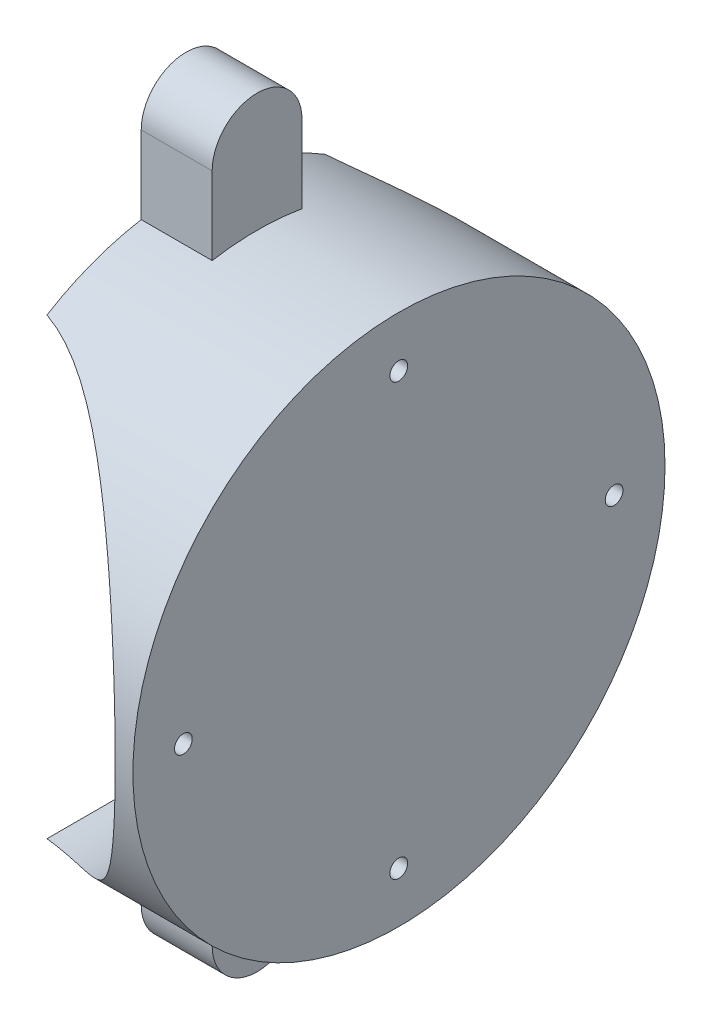
from build123d import *

# Parameters (mm, degrees)
SKETCH1_R               = 75
BOSS_EXTRUDE1_DEPTH     = 60
BOSS_EXTRUDE2_DEPTH     = 20
SKETCH6_R               = 2.5
CUT_EXTRUDE4_DEPTH      = 145.896339998
CIRPATTERN1_COUNT       = 4
CUT_EXTRUDE3_DEPTH      = 145.896339998
CUT_EXTRUDE3_DEPTH_BACK = 145.896339998


with BuildPart() as part:
    # Sketch1 → Boss-Extrude1 (new body)
    with BuildSketch(Plane(origin=(0, 0, 0), x_dir=(0, 0, -1), z_dir=(1, 0, 0))):
        with Locations(Location((0, 0, 0), (0, 0, 180))):
            Circle(SKETCH1_R)
    extrude(amount=BOSS_EXTRUDE1_DEPTH)

    # Sketch5 → Boss-Extrude2 (add)
    with BuildSketch(Plane(origin=(0, 0, 0), x_dir=(0, 0, -1), z_dir=(1, 0, 0))):
        with BuildLine():
            Line((12.661492774, 95.827904611), (12.661492774, -93.388552108))
            ThreePointArc((12.661492774, -93.388552108), (0, -106.050044882), (-12.661492774, -93.388552108))
            Line((-12.661492774, -93.388552108), (-12.661492774, 95.827904611))
            ThreePointArc((-12.661492774, 95.827904611), (0, 108.489397385), (12.661492774, 95.827904611))
        make_face()
    extrude(amount=BOSS_EXTRUDE2_DEPTH)

    # Sketch6 → Cut-Extrude4 (cut, symmetric)
    with BuildSketch(Plane(origin=(0, 0, 0), x_dir=(0, 0, -1), z_dir=(1, 0, 0))):
        with Locations(Location((60.640992129, 0, 0), (0, 0, 180))):
            Circle(SKETCH6_R)
    cut_extrude4 = extrude(amount=CUT_EXTRUDE4_DEPTH, both=True, mode=Mode.SUBTRACT)

    # CirPattern1: Cut-Extrude4 ×4 about axis
    cirpattern1_axis = Axis((0, 0, 0.067453829), (1, 0, 0))
    for i in range(1, CIRPATTERN1_COUNT):
        add(cut_extrude4.rotate(cirpattern1_axis, i * 360 / CIRPATTERN1_COUNT), mode=Mode.SUBTRACT)

    # Sketch3 → Cut-Extrude3 (cut, two sides: drawn at the far end of the back side and taken through both)
    with BuildSketch(Plane.XY.offset(-CUT_EXTRUDE3_DEPTH_BACK)):
        with BuildLine():
            Line((0, 63.92351859), (0, -63.92351859))
            ThreePointArc((0, -63.92351859), (55, 0), (0, 63.92351859))
        make_face()
    extrude(amount=CUT_EXTRUDE3_DEPTH + CUT_EXTRUDE3_DEPTH_BACK, mode=Mode.SUBTRACT)


solid = part.part
